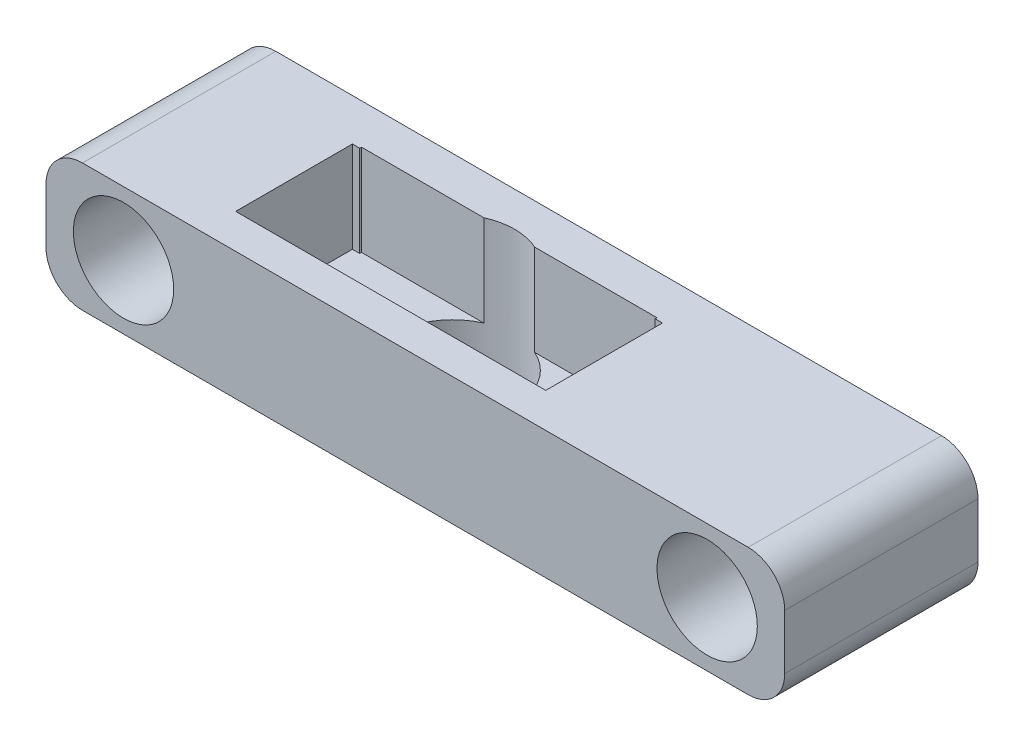
from build123d import *

# Parameters (mm, degrees)
CROQUIS1_W              = 40.5
CROQUIS1_H              = 7
CROQUIS1_R              = 2.75
SALIENTE_EXTRUIR1_DEPTH = 10.6
CROQUIS5_R              = 3.4
CORTAR_EXTRUIR4_DEPTH   = 7
REDONDEO1_R             = 2
CROQUIS7_W              = 17
CROQUIS7_H              = 6.4
CORTAR_EXTRUIR5_DEPTH   = 5
CROQUIS8_R              = 1.5
CORTAR_EXTRUIR6_DEPTH   = 2
CROQUIS9_W              = 16.2
CROQUIS9_H              = 6.2
CORTAR_EXTRUIR7_DEPTH   = 5


with BuildPart() as part:
    # Croquis1 → Saliente-Extruir1 (new body)
    with BuildSketch(Plane.XY):
        with Locations((-26.183013117, -10.786568945)):
            Rectangle(CROQUIS1_W, CROQUIS1_H)
        with Locations((-42.183013117, -10.786568945)):
            Circle(CROQUIS1_R, mode=Mode.SUBTRACT)
        with Locations((-10.183013117, -10.786568945)):
            Circle(CROQUIS1_R, mode=Mode.SUBTRACT)
    extrude(amount=SALIENTE_EXTRUIR1_DEPTH)

    # Croquis5 → Cortar-Extruir4 (cut)
    with BuildSketch(Plane.XZ.offset(14.286568945)):
        with Locations(Location((-29.433013117, 5.3, 0), (0, 0, 270))):
            Circle(CROQUIS5_R)
    extrude(amount=-CORTAR_EXTRUIR4_DEPTH, mode=Mode.SUBTRACT)

    # Redondeo1
    redondeo1_edges = [part.edges().sort_by_distance(p)[0] for p in [
        (-46.433013117, -7.286568945, 5.3),
        (-5.933013117, -7.286568945, 5.3),
        (-5.933013117, -14.286568945, 5.3),
        (-46.433013117, -14.286568945, 5.3),
    ]]
    fillet(redondeo1_edges, radius=REDONDEO1_R)

    # Croquis7 → Cortar-Extruir5 (cut)
    with BuildSketch(Plane(origin=(0, -7.286568945, 0), x_dir=(1, 0, 0), z_dir=(0, 1, 0))):
        with Locations((-29.433013117, -5.5)):
            Rectangle(CROQUIS7_W, CROQUIS7_H)
    extrude(amount=-CORTAR_EXTRUIR5_DEPTH, mode=Mode.SUBTRACT)

    # Croquis8 → Cortar-Extruir6 (cut)
    with BuildSketch(Plane(origin=(0, -12.286568945, 0), x_dir=(1, 0, 0), z_dir=(0, 1, 0))):
        with Locations(Location((-22.933013117, -5.5, 0), (0, 0, 270))):
            Circle(CROQUIS8_R)
        with Locations(Location((-35.933013117, -5.5, 0), (0, 0, 270))):
            Circle(CROQUIS8_R)
    extrude(amount=-CORTAR_EXTRUIR6_DEPTH, mode=Mode.SUBTRACT)

    # Croquis9 → Cortar-Extruir7 (cut)
    with BuildSketch(Plane(origin=(0, -7.286568945, 0), x_dir=(1, 0, 0), z_dir=(0, 1, 0))):
        with Locations((-29.433013117, -5.3)):
            Rectangle(CROQUIS9_W, CROQUIS9_H)
    extrude(amount=-CORTAR_EXTRUIR7_DEPTH, mode=Mode.SUBTRACT)


solid = part.part
